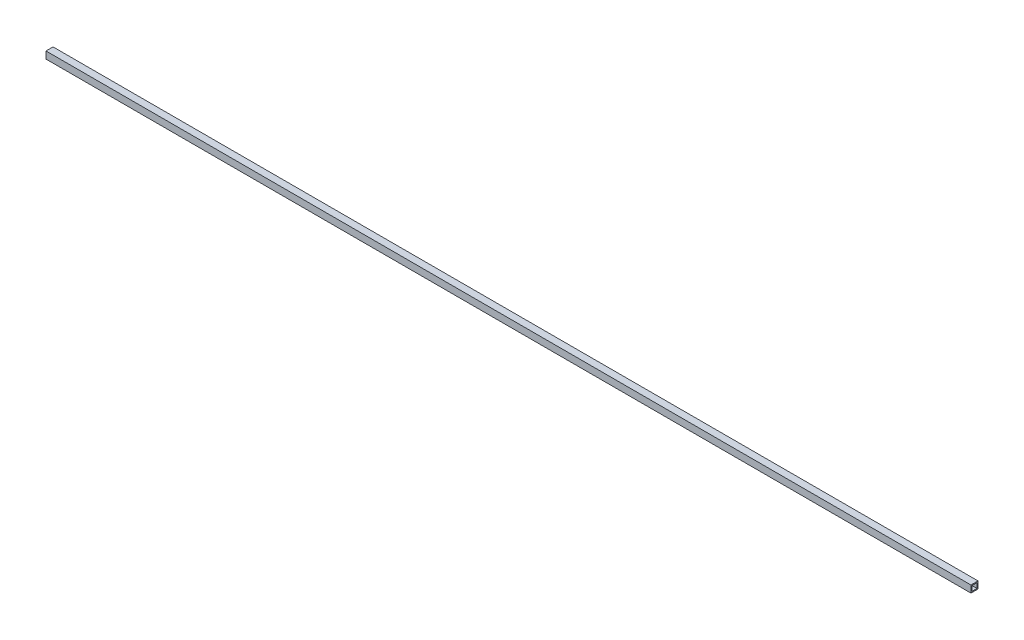
from build123d import *

# Parameters (mm, degrees)
SKETCH1_W           = 1310
SKETCH1_H           = 10
BOSS_EXTRUDE1_DEPTH = 10
SKETCH2_W           = 7
SKETCH2_H           = 7
CUT_EXTRUDE1_DEPTH  = 1311.076333654


with BuildPart() as part:
    # Sketch1 → Boss-Extrude1 (new body)
    with BuildSketch(Plane(origin=(0, 0, 0), x_dir=(1, 0, 0), z_dir=(0, 1, 0))):
        with Locations((655, -5)):
            Rectangle(SKETCH1_W, SKETCH1_H)
    extrude(amount=BOSS_EXTRUDE1_DEPTH)

    # Sketch2 → Cut-Extrude1 (cut, through all)
    with BuildSketch(Plane(origin=(1310, 0, 0), x_dir=(0, 0, -1), z_dir=(1, 0, 0))):
        with Locations((-5, 5)):
            Rectangle(SKETCH2_W, SKETCH2_H)
    extrude(amount=-CUT_EXTRUDE1_DEPTH, mode=Mode.SUBTRACT)


solid = part.part
